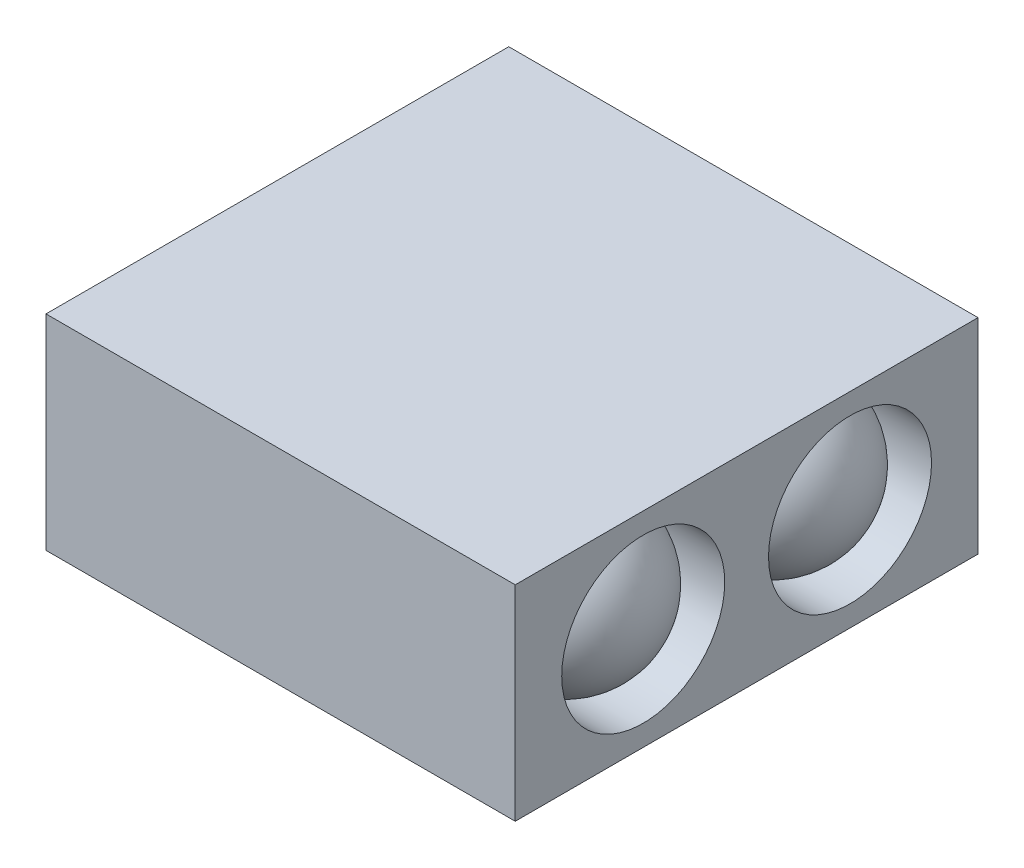
from build123d import *

# Parameters (mm, degrees)
SKETCH1_W           = 362
SKETCH1_H           = 357
BOSS_EXTRUDE1_DEPTH = 158
SKETCH2_R           = 62.877116211
CUT_EXTRUDE1_DEPTH  = 60
REVOLVE1_ANGLE      = 180
REVOLVE2_ANGLE      = 180


with BuildPart() as part:
    # Sketch1 → Boss-Extrude1 (new body)
    with BuildSketch(Plane(origin=(0, 0, 0), x_dir=(1, 0, 0), z_dir=(0, 1, 0))):
        Rectangle(SKETCH1_W, SKETCH1_H)
    extrude(amount=BOSS_EXTRUDE1_DEPTH)

    # Sketch2 → Cut-Extrude1 (cut)
    with BuildSketch(Plane(origin=(181, 0, 0), x_dir=(0, 0, -1), z_dir=(1, 0, 0))):
        with Locations((-79.77402599, 79)):
            Circle(SKETCH2_R)
        with Locations((79.77402599, 79)):
            Circle(SKETCH2_R)
    extrude(amount=-CUT_EXTRUDE1_DEPTH, mode=Mode.SUBTRACT)

    # Sketch3 → Revolve1 (revolve)
    with BuildSketch(Plane(origin=(121, 0, 0), x_dir=(0, 0, -1), z_dir=(1, 0, 0))):
        with BuildLine():
            Line((-79.77402599, 141.877116211), (-79.77402599, 16.122883789))
            ThreePointArc((-79.77402599, 16.122883789), (-142.651142201, 79), (-79.77402599, 141.877116211))
        make_face()
    revolve(axis=Axis((121, 141.877116211, 79.77402599), (0, 1, 0)), revolution_arc=REVOLVE1_ANGLE)

    # Sketch4 → Revolve2 (revolve)
    with BuildSketch(Plane(origin=(121, 0, 0), x_dir=(0, 0, -1), z_dir=(1, 0, 0))):
        with BuildLine():
            Line((79.77402599, 141.877116211), (79.77402599, 16.122883789))
            ThreePointArc((79.77402599, 16.122883789), (16.896909779, 79), (79.77402599, 141.877116211))
        make_face()
    revolve(axis=Axis((121, 141.877116211, -79.77402599), (0, 1, 0)), revolution_arc=REVOLVE2_ANGLE)


solid = part.part
